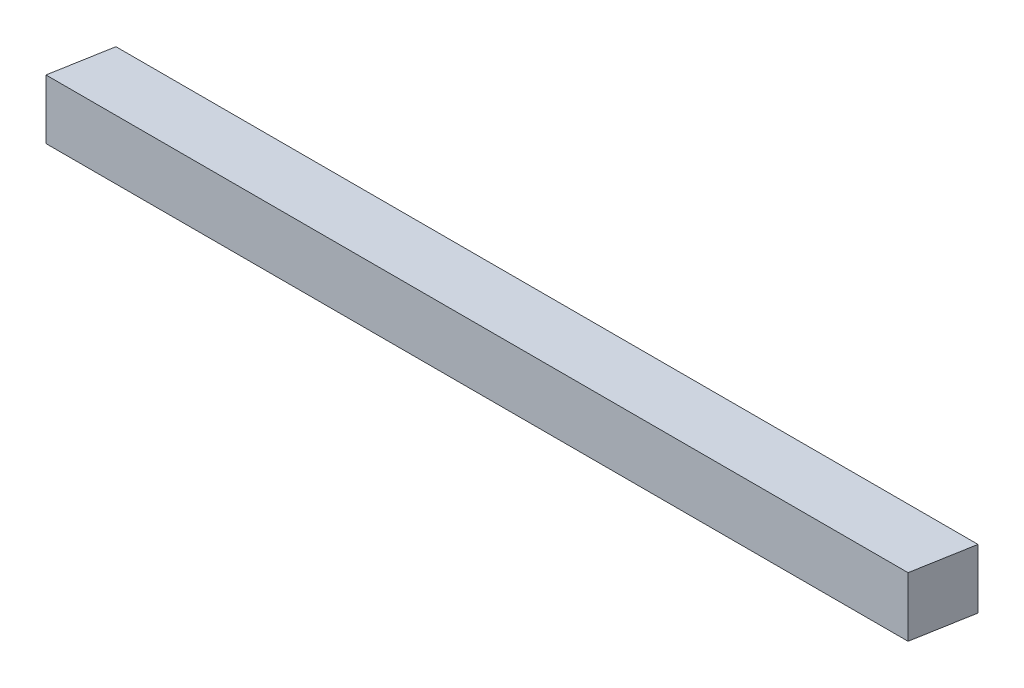
from build123d import *

# Parameters (mm, degrees)
BOSS_EXTRUDE1_DEPTH = 12.7


with BuildPart() as part:
    # Sketch1 → Boss-Extrude1 (new body)
    with BuildSketch(Plane(origin=(0, 0, 0), x_dir=(1, 0, 0), z_dir=(0, 1, 0))):
        Polygon((0, 0), (2.239352655, 12.7), (186.389352655, 12.7), (184.15, 0), align=None)
    extrude(amount=BOSS_EXTRUDE1_DEPTH)


solid = part.part
